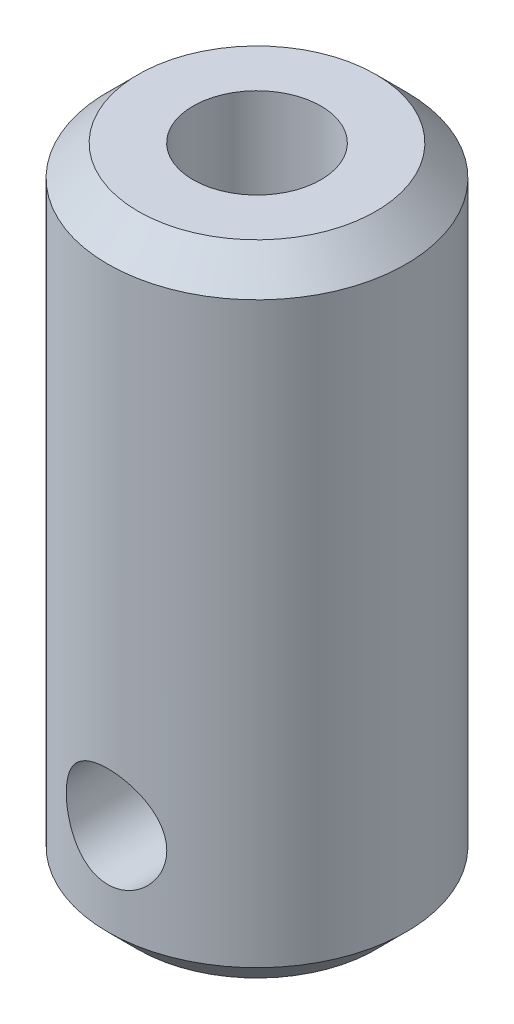
from build123d import *

# Parameters (mm, degrees)
SKETCH_1_R             = 4.9
EXTRUDE_1_DEPTH        = 21
HOLE_WIZARD_M4_1_D     = 3.3
HOLE_WIZARD_M5_1_D     = 4.2
HOLE_WIZARD_M5_1_DEPTH = 12
HOLE_WIZARD_M5_1_TIP   = 1.2618073
CHAMFER_1_SIZE         = 1


with BuildPart() as part:
    # 草图1 → 凸台-拉伸1 (new body)
    with BuildSketch(Plane(origin=(0, 0, 0), x_dir=(1, 0, 0), z_dir=(0, 1, 0))):
        with Locations(Location((0, 0, 0), (0, 0, 90))):
            Circle(SKETCH_1_R)
    extrude(amount=EXTRUDE_1_DEPTH)

    # M4 螺纹孔1 (through all)
    with Locations(Plane.XY.offset(4.9)):
        with Locations((0, 4)):
            Hole(HOLE_WIZARD_M4_1_D / 2)

    # M5 螺纹孔1
    with Locations(Plane(origin=(0, 21, 0), x_dir=(1, 0, 0), z_dir=(0, 1, 0))):
        with Locations((0, 0)):
            Hole(HOLE_WIZARD_M5_1_D / 2, depth=HOLE_WIZARD_M5_1_DEPTH)
            with Locations((0, 0, -(HOLE_WIZARD_M5_1_DEPTH + HOLE_WIZARD_M5_1_TIP / 2))):  # 118° drill point
                Cone(0, HOLE_WIZARD_M5_1_D / 2, HOLE_WIZARD_M5_1_TIP, mode=Mode.SUBTRACT)

    # 倒角1
    chamfer_1_edges = [part.edges().sort_by_distance(p)[0] for p in [
        (0, 0, 4.9),
        (0, 21, 4.9),
    ]]
    chamfer(chamfer_1_edges, length=CHAMFER_1_SIZE)


solid = part.part
